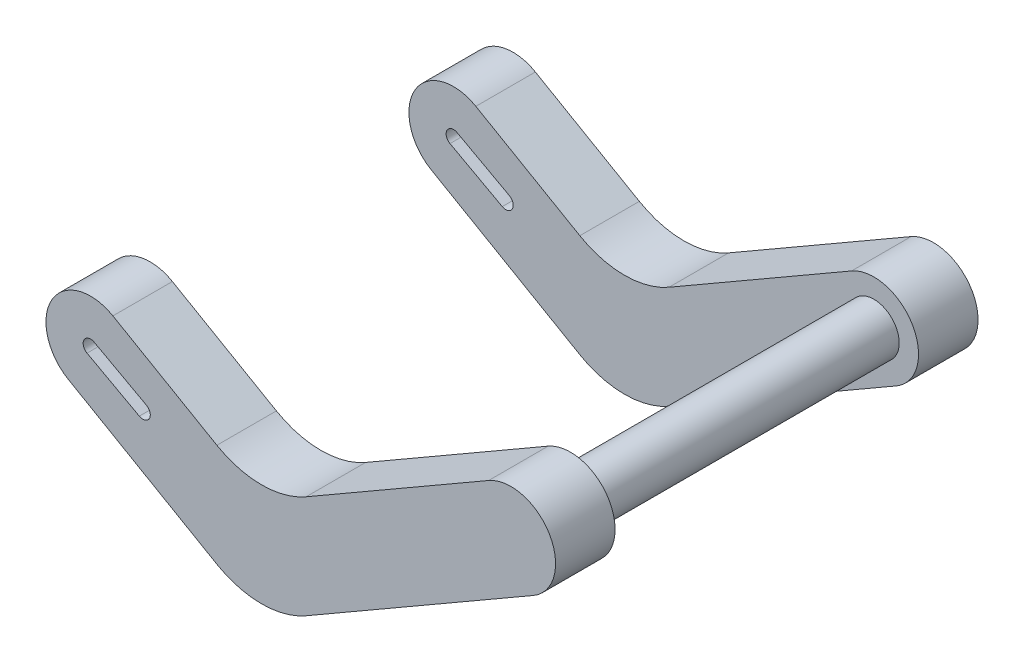
from build123d import *

# Parameters (mm, degrees)
BOSS_EXTRUDE1_DEPTH = 2
SKETCH2_R           = 0.85
BOSS_EXTRUDE2_DEPTH = 10.2
FILLET1_R           = 3


with BuildPart() as part:
    # Sketch1 → Boss-Extrude1 (new body)
    with BuildSketch(Plane.XY):
        with BuildLine():
            Line((-7.01, 5.520677243), (-2.014670258, 2.636622271))
            Line((-2.014670258, 2.636622271), (5.62, 7.0445012))
            ThreePointArc((5.62, 7.0445012), (7.669038106, 6.495463094), (7.12, 4.446424988))
            Line((7.12, 4.446424988), (-0.514670258, 0.03854606))
            ThreePointArc((-0.514670258, 0.03854606), (-2.014670258, -0.363377729), (-3.514670258, 0.03854606))
            Line((-3.514670258, 0.03854606), (-8.51, 2.922601032))
            ThreePointArc((-8.51, 2.922601032), (-9.059038106, 4.971639137), (-7.01, 5.520677243))
        make_face()
        with BuildLine():
            Line((-7.640528879, 4.441244809), (-5.883683502, 3.48547584))
            ThreePointArc((-5.883683502, 3.48547584), (-5.783548951, 3.146399047), (-6.122625744, 3.046264496))
            Line((-6.122625744, 3.046264496), (-7.879471121, 4.002033465))
            ThreePointArc((-7.879471121, 4.002033465), (-7.979605672, 4.341110258), (-7.640528879, 4.441244809))
        make_face(mode=Mode.SUBTRACT)
    boss_extrude1 = extrude(amount=BOSS_EXTRUDE1_DEPTH)

    # Sketch2 → Boss-Extrude2 (add)
    with BuildSketch(Plane.XY.offset(2)):
        with Locations((6.37, 5.745463094)):
            Circle(SKETCH2_R)
    extrude(amount=BOSS_EXTRUDE2_DEPTH)

    # Mirror1: Boss-Extrude1 across plane
    add(boss_extrude1.mirror(Plane.XY.offset(7.1)))

    # Fillet1
    fillet1_edges = [part.edges().sort_by_distance(p)[0] for p in [
        (-2.014670258, 2.636622271, 1),
        (-2.014670258, 2.636622271, 13.2),
    ]]
    fillet(fillet1_edges, radius=FILLET1_R)


solid = part.part
